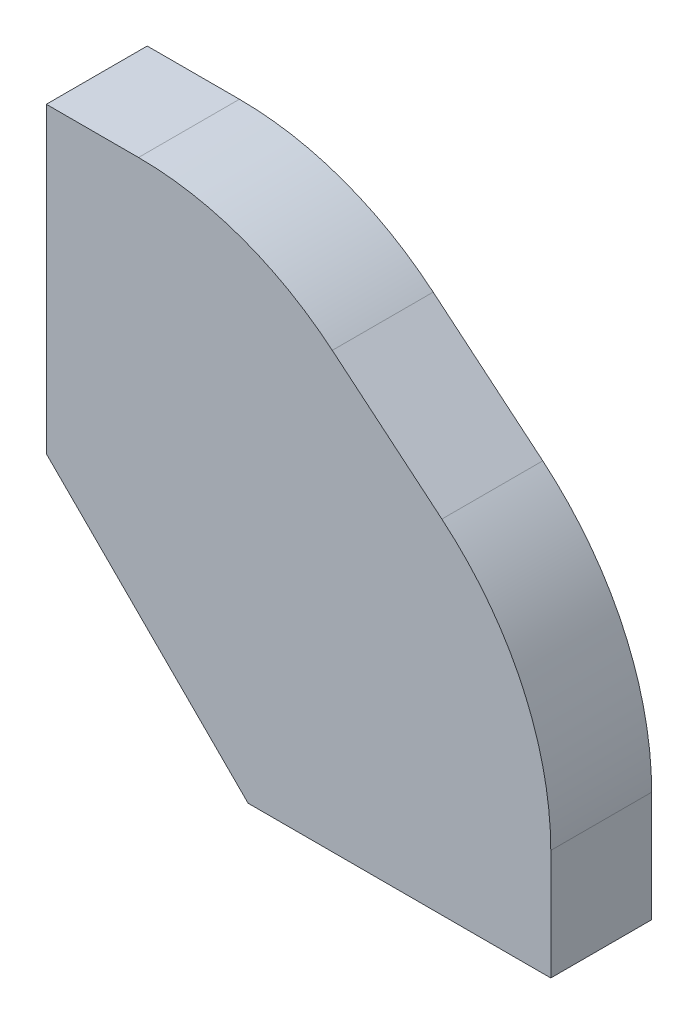
from build123d import *

# Parameters (mm, degrees)
BOSS_EXTRU_1_DEPTH = 10


with BuildPart() as part:
    # Esquisse1 → Boss.-Extru.1 (new body)
    with BuildSketch(Plane.XY):
        with BuildLine():
            Line((0, 20), (0, 50))
            Line((0, 50), (9.138501945, 50))
            ThreePointArc((9.138501945, 50), (19.351259857, 48.20814733), (28.344033934, 43.046638388))
            Line((28.344033934, 43.046638388), (39.20553199, 33.995390008))
            ThreePointArc((39.20553199, 33.995390008), (47.167682637, 23.673413508), (50, 10.94875162))
            Line((50, 10.94875162), (50, 0))
            Line((50, 0), (20, 0))
            Line((20, 0), (0, 20))
        make_face()
    extrude(amount=BOSS_EXTRU_1_DEPTH)


solid = part.part
